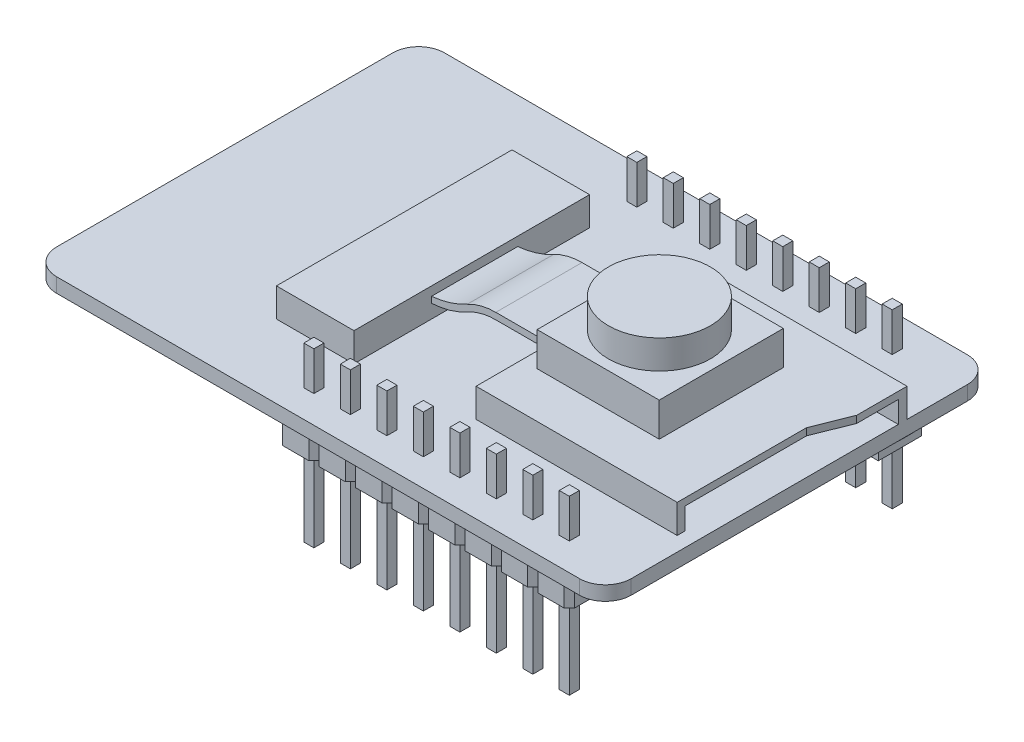
from build123d import *

# Parameters (mm, degrees)
SKETCH_1_W         = 40
SKETCH_1_H         = 27
EXTRUDE_1_DEPTH    = 1
FILLET_1_R         = 1.8
SKETCH_4_W         = 25.5
SKETCH_4_H         = 18
ESP32_DEPTH        = 1
ESP32_2_DEPTH      = 2.4
SKETCH_6_W         = 2.8
SKETCH_6_H         = 2.4
EXTRUDE_1613_DEPTH = 0.5
SKETCH_7_R         = 0.10095191
EXTRUDE_1749_DEPTH = 0.5
SKETCH_8_R         = 1
SKETCH_8_R_2       = 0.774591052
EXTRUDE_1922_DEPTH = 0.5
EXTRUDE_2358_DEPTH = 0.1
SKETCH_10_W        = 4
SKETCH_10_H        = 5
FLASH_DEPTH        = 1.5
EXTRUDE_4523_DEPTH = 2.3
SKETCH_3_W         = 0.7
SKETCH_3_H         = 0.7
EXTRUDE_5784_DEPTH = 6
SKETCH_11_W        = 3.5
SKETCH_11_H        = 6.5
AMS1117_DEPTH      = 1.5
SKETCH_12_W        = 4
SKETCH_12_H        = 3
EXTRUDE_6243_DEPTH = 1.5
SKETCH_13_R        = 0.870557087
EXTRUDE_6433_DEPTH = 0.5
SKETCH_14_W        = 1.736410673
SKETCH_14_H        = 3.378003939
SKETCH_14_W_2      = 2.095155041
SKETCH_14_H_2      = 1
SKETCH_14_W_3      = 1.766738633
SKETCH_14_H_3      = 0.57826537
SKETCH_14_W_4      = 0.5
SKETCH_14_W_5      = 0.511797239
EXTRUDE_7106_DEPTH = 0.5
SD_DEPTH           = 2
SKETCH_16_W        = 13.843040366
SKETCH_16_H        = 1.506755829
SD_2_DEPTH         = 14
SKETCH_17_W        = 8.5
SKETCH_17_H        = 8.64
OV2640_DEPTH       = 2.36
SKETCH_18_R        = 3.55
OV2640_2_DEPTH     = 2
SKETCH_19_W        = 5.4
SKETCH_19_H        = 16.4
EXTRUDE_18_DEPTH   = 2
EXTRUDE_19_DEPTH   = 3


with BuildPart() as part:
    # 草图1 → 凸台-拉伸1 (new body)
    with BuildSketch(Plane(origin=(0, 0, 0), x_dir=(1, 0, 0), z_dir=(0, 1, 0))):
        Rectangle(SKETCH_1_W, SKETCH_1_H)
    extrude(amount=EXTRUDE_1_DEPTH)

    # 圆角1
    fillet_1_edges = [part.edges().sort_by_distance(p)[0] for p in [
        (-20, 0.5, -13.5),
        (20, 0.5, -13.5),
        (20, 0.5, 13.5),
        (-20, 0.5, 13.5),
    ]]
    fillet(fillet_1_edges, radius=FILLET_1_R)

    # 草图4 → esp32 (add)
    with BuildSketch(Plane.XZ):
        with Locations((-7.25, 0)):
            Rectangle(SKETCH_4_W, SKETCH_4_H)
    extrude(amount=ESP32_DEPTH)

    # 草图5 → esp32 2 (add)
    with BuildSketch(Plane.XZ.offset(1)):
        Polygon((-12.65, 2.15), (-9.41, 2.15), (-9.41, 7.85), (4.35, 7.85), (4.35, -7.85), (-9.079809859, -7.85), (-12.65, -7.85), align=None)
    extrude(amount=ESP32_2_DEPTH)

    # 草图6 → Extrude 1613 (add)
    with BuildSketch(Plane.XZ.offset(1)):
        with Locations((-12.6, 6.8)):
            Rectangle(SKETCH_6_W, SKETCH_6_H)
    extrude(amount=EXTRUDE_1613_DEPTH)

    # 草图7 → Extrude 1749 (add)
    with BuildSketch(Plane.XZ.offset(1.5)):
        with Locations(Location((-12.634547218, 6.84503639, 0), (0, 0, 270))):
            Circle(SKETCH_7_R)
    extrude(amount=EXTRUDE_1749_DEPTH)

    # 草图8 → Extrude 1922 (add)
    with BuildSketch(Plane.XZ.offset(1.5)):
        with Locations(Location((-12.634547218, 6.84503639, 0), (0, 0, 270))):
            Circle(SKETCH_8_R)
        with Locations(Location((-12.634547218, 6.84503639, 0), (0, 0, 270))):
            Circle(SKETCH_8_R_2, mode=Mode.SUBTRACT)
    extrude(amount=EXTRUDE_1922_DEPTH)

    # 草图9 → Extrude 2358 (add)
    with BuildSketch(Plane.XZ.offset(1)):
        Polygon((-15.544769203, -7.993846837), (-18.544769203, -7.993846837), (-18.544769203, -4.993846837), (-15.544769203, -4.993846837), (-15.544769203, -1.993846837), (-18.544769203, -1.993846837), (-18.544769203, 1.006153163), (-15.544769203, 1.006153163), (-15.544769203, 4.006153163), (-18.544769203, 4.006153163), (-18.544769203, 7.006153163), (-15.544769203, 7.006153163), (-15.544769203, 8.340463502), (-19.270898352, 8.340463502), (-19.270898352, 3.401176026), (-16.021367117, 3.401176026), (-16.021367117, 1.581438534), (-19.270898352, 1.581438534), (-19.270898352, -2.751269779), (-16.021367117, -2.751269779), (-16.021367117, -4.397698938), (-19.270898352, -4.397698938), (-19.270898352, -8.600426001), (-13.898340044, -8.600426001), (-13.898340044, -7.993846837), align=None)
    extrude(amount=EXTRUDE_2358_DEPTH)

    # 草图10 → FLASH (add)
    with BuildSketch(Plane.XZ):
        with Locations((14.5, 6.9)):
            Rectangle(SKETCH_10_W, SKETCH_10_H)
    extrude(amount=FLASH_DEPTH)

    # 草图2 → Extrude 4523 (add)
    with BuildSketch(Plane.XZ):
        Polygon((-3.820754679, 12.156555373), (-3.820754679, 10.323662154), (-3.467201288, 9.970108763), (-1.634308069, 9.970108763), (-1.280754679, 10.323662154), (-0.927201288, 9.970108763), (0.905691931, 9.970108763), (1.259245321, 10.323662154), (1.612798712, 9.970108763), (3.445691931, 9.970108763), (3.799245321, 10.323662154), (4.152798712, 9.970108763), (5.985691931, 9.970108763), (6.339245321, 10.323662154), (6.692798712, 9.970108763), (8.525691931, 9.970108763), (8.879245321, 10.323662154), (9.232798712, 9.970108763), (11.065691931, 9.970108763), (11.419245321, 10.323662154), (11.772798712, 9.970108763), (13.605691931, 9.970108763), (13.959245321, 10.323662154), (14.312798712, 9.970108763), (16.145691931, 9.970108763), (16.499245321, 10.323662154), (16.499245321, 12.156555373), (16.145691931, 12.510108763), (14.312798712, 12.510108763), (13.959245321, 12.156555373), (13.605691931, 12.510108763), (11.772798712, 12.510108763), (11.419245321, 12.156555373), (11.065691931, 12.510108763), (9.232798712, 12.510108763), (8.879245321, 12.156555373), (8.525691931, 12.510108763), (6.692798712, 12.510108763), (6.339245321, 12.156555373), (5.985691931, 12.510108763), (4.152798712, 12.510108763), (3.799245321, 12.156555373), (3.445691931, 12.510108763), (1.612798712, 12.510108763), (1.259245321, 12.156555373), (0.905691931, 12.510108763), (-0.927201288, 12.510108763), (-1.280754679, 12.156555373), (-1.634308069, 12.510108763), (-3.467201288, 12.510108763), align=None)
        Polygon((14.312798712, -12.510108763), (13.959245321, -12.156555373), (13.605691931, -12.510108763), (11.772798712, -12.510108763), (11.419245321, -12.156555373), (11.065691931, -12.510108763), (9.232798712, -12.510108763), (8.879245321, -12.156555373), (8.525691931, -12.510108763), (6.692798712, -12.510108763), (6.339245321, -12.156555373), (5.985691931, -12.510108763), (4.152798712, -12.510108763), (3.799245321, -12.156555373), (3.445691931, -12.510108763), (1.612798712, -12.510108763), (1.259245321, -12.156555373), (0.905691931, -12.510108763), (-0.927201288, -12.510108763), (-1.280754679, -12.156555373), (-1.634308069, -12.510108763), (-3.467201288, -12.510108763), (-3.820754679, -12.156555373), (-3.820754679, -10.323662154), (-3.467201288, -9.970108763), (-1.634308069, -9.970108763), (-1.280754679, -10.323662154), (-0.927201288, -9.970108763), (0.905691931, -9.970108763), (1.259245321, -10.323662154), (1.612798712, -9.970108763), (3.445691931, -9.970108763), (3.799245321, -10.323662154), (4.152798712, -9.970108763), (5.985691931, -9.970108763), (6.339245321, -10.323662154), (6.692798712, -9.970108763), (8.525691931, -9.970108763), (8.879245321, -10.323662154), (9.232798712, -9.970108763), (11.065691931, -9.970108763), (11.419245321, -10.323662154), (11.772798712, -9.970108763), (13.605691931, -9.970108763), (13.959245321, -10.323662154), (14.312798712, -9.970108763), (16.145691931, -9.970108763), (16.499245321, -10.323662154), (16.499245321, -12.156555373), (16.145691931, -12.510108763), align=None)
    extrude(amount=EXTRUDE_4523_DEPTH)

    # 草图3 → Extrude 5784 (add, symmetric)
    with BuildSketch(Plane.XZ.offset(2.3)):
        with Locations((-2.550754679, 11.240108763)):
            Rectangle(SKETCH_3_W, SKETCH_3_H)
        with Locations((-0.010754679, 11.240108763)):
            Rectangle(SKETCH_3_W, SKETCH_3_H)
        with Locations((2.529245321, 11.240108763)):
            Rectangle(SKETCH_3_W, SKETCH_3_H)
        with Locations((5.069245321, 11.240108763)):
            Rectangle(SKETCH_3_W, SKETCH_3_H)
        with Locations((7.609245321, 11.240108763)):
            Rectangle(SKETCH_3_W, SKETCH_3_H)
        with Locations((10.149245321, 11.240108763)):
            Rectangle(SKETCH_3_W, SKETCH_3_H)
        with Locations((12.689245321, 11.240108763)):
            Rectangle(SKETCH_3_W, SKETCH_3_H)
        with Locations((15.229245321, 11.240108763)):
            Rectangle(SKETCH_3_W, SKETCH_3_H)
        with Locations((-2.550754679, -11.240108763)):
            Rectangle(SKETCH_3_W, SKETCH_3_H)
        with Locations((15.229245321, -11.240108763)):
            Rectangle(SKETCH_3_W, SKETCH_3_H)
        with Locations((12.689245321, -11.240108763)):
            Rectangle(SKETCH_3_W, SKETCH_3_H)
        with Locations((10.149245321, -11.240108763)):
            Rectangle(SKETCH_3_W, SKETCH_3_H)
        with Locations((7.609245321, -11.240108763)):
            Rectangle(SKETCH_3_W, SKETCH_3_H)
        with Locations((5.069245321, -11.240108763)):
            Rectangle(SKETCH_3_W, SKETCH_3_H)
        with Locations((2.529245321, -11.240108763)):
            Rectangle(SKETCH_3_W, SKETCH_3_H)
        with Locations((-0.010754679, -11.240108763)):
            Rectangle(SKETCH_3_W, SKETCH_3_H)
    extrude(amount=EXTRUDE_5784_DEPTH, both=True)

    # 草图11 → AMS1117 (add)
    with BuildSketch(Plane.XZ):
        with Locations((15.25, -1.25)):
            Rectangle(SKETCH_11_W, SKETCH_11_H)
    extrude(amount=AMS1117_DEPTH)

    # 草图12 → Extrude 6243 (add)
    with BuildSketch(Plane.XZ):
        with Locations((17, -8)):
            Rectangle(SKETCH_12_W, SKETCH_12_H)
    extrude(amount=EXTRUDE_6243_DEPTH)

    # 草图13 → Extrude 6433 (add)
    with BuildSketch(Plane.XZ.offset(1.5)):
        with Locations(Location((17, -8, 0), (0, 0, 270))):
            Circle(SKETCH_13_R)
    extrude(amount=EXTRUDE_6433_DEPTH)

    # 草图14 → Extrude 7106 (add)
    with BuildSketch(Plane.XZ):
        with Locations((17.868205337, -1.184137832)):
            Rectangle(SKETCH_14_W, SKETCH_14_H)
        with Locations((12.45242248, 0.908837023)):
            Rectangle(SKETCH_14_W_2, SKETCH_14_H_2)
        with Locations((12.456177996, -1.160349072)):
            Rectangle(SKETCH_14_W_2, SKETCH_14_H_2)
        with Locations((12.456177996, -3.253759964)):
            Rectangle(SKETCH_14_W_2, SKETCH_14_H_2)
        with Locations((17.383369317, 8.762932478)):
            Rectangle(SKETCH_14_W_3, SKETCH_14_H_3)
        with Locations((17.383369317, 7.632853308)):
            Rectangle(SKETCH_14_W_3, SKETCH_14_H_3)
        with Locations((17.383369317, 6.334217924)):
            Rectangle(SKETCH_14_W_3, SKETCH_14_H_3)
        with Locations((17.383369317, 5.098390509)):
            Rectangle(SKETCH_14_W_3, SKETCH_14_H_3)
        with Locations((11.616630684, 5.098390509)):
            Rectangle(SKETCH_14_W_3, SKETCH_14_H_3)
        with Locations((11.616630684, 6.334217924)):
            Rectangle(SKETCH_14_W_3, SKETCH_14_H_3)
        with Locations((11.616630684, 7.632853308)):
            Rectangle(SKETCH_14_W_3, SKETCH_14_H_3)
        with Locations((11.616630684, 8.762932478)):
            Rectangle(SKETCH_14_W_3, SKETCH_14_H_3)
        with Locations((14.75, -7.936837685)):
            Rectangle(SKETCH_14_W_4, SKETCH_14_H_2)
        with Locations((19.25589862, -7.936837685)):
            Rectangle(SKETCH_14_W_5, SKETCH_14_H_2)
    extrude(amount=EXTRUDE_7106_DEPTH)

    # 草图15 → SD (add)
    with BuildSketch(Plane(origin=(0, 1, 0), x_dir=(1, 0, 0), z_dir=(0, 1, 0))):
        Polygon((5, 7.5), (5, -7.5), (19, -7.5), (19, 1.5), (20, 4), (20, 7.5), align=None)
    extrude(amount=SD_DEPTH)

    # 草图16 → SD 2 (cut)
    with BuildSketch(Plane(origin=(20, 0, 0), x_dir=(0, 0, -1), z_dir=(1, 0, 0))):
        with Locations((-0.028308876, 1.753377915)):
            Rectangle(SKETCH_16_W, SKETCH_16_H)
    extrude(amount=-SD_2_DEPTH, mode=Mode.SUBTRACT)

    # 草图17 → OV2640 (add)
    with BuildSketch(Plane(origin=(0, 3, 0), x_dir=(1, 0, 0), z_dir=(0, 1, 0))):
        with Locations((10.320261797, 0)):
            Rectangle(SKETCH_17_W, SKETCH_17_H)
    extrude(amount=OV2640_DEPTH)

    # 草图18 → OV2640 2 (add)
    with BuildSketch(Plane(origin=(0, 5.36, 0), x_dir=(1, 0, 0), z_dir=(0, 1, 0))):
        with Locations(Location((10.320261797, -0.059710743, 0), (0, 0, 270))):
            Circle(SKETCH_18_R)
    extrude(amount=OV2640_2_DEPTH)

    # 草图19 → 凸台-拉伸18 (add)
    with BuildSketch(Plane(origin=(0, 1, 0), x_dir=(1, 0, 0), z_dir=(0, 1, 0))):
        with Locations((-5.3, -0.2)):
            Rectangle(SKETCH_19_W, SKETCH_19_H)
    extrude(amount=EXTRUDE_18_DEPTH)

    # 草图20 → 凸台-拉伸19 (add, symmetric)
    with BuildSketch(Plane.XY):
        with BuildLine():
            Line((6.070261797, 3.643183356), (1.874300797, 3.643183356))
            ThreePointArc((1.874300797, 3.643183356), (0.848357759, 3.514351265), (-0.113877871, 3.135855006))
            ThreePointArc((-0.113877871, 3.135855006), (-1.462957505, 2.585618042), (-2.900754679, 2.35))
            Line((-2.900754679, 2.35), (-2.900754679, 1.942947805))
            ThreePointArc((-2.900754679, 1.942947805), (-1.460720394, 2.127613864), (-0.113877871, 2.669661387))
            ThreePointArc((-0.113877871, 2.669661387), (0.846969614, 3.056362126), (1.874300797, 3.188104268))
            Line((1.874300797, 3.188104268), (6.070261797, 3.188104268))
            Line((6.070261797, 3.188104268), (6.070261797, 3.643183356))
        make_face()
    extrude(amount=EXTRUDE_19_DEPTH, both=True)


solid = part.part
